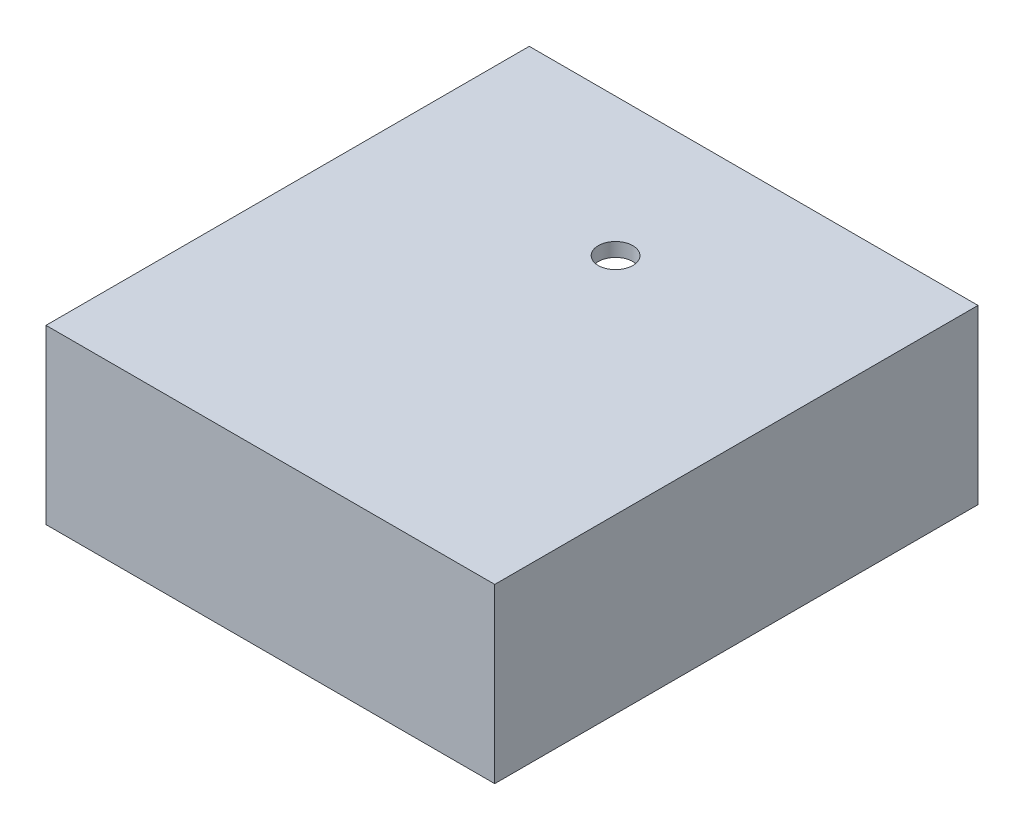
from build123d import *

# Parameters (mm, degrees)
SKETCH1_W           = 65
SKETCH1_H           = 70
BOSS_EXTRUDE1_DEPTH = 25
SKETCH8_W           = 61
SKETCH8_H           = 21
CUT_EXTRUDE1_DEPTH  = 40
SKETCH9_R           = 2.5
CUT_EXTRUDE2_DEPTH  = 30


with BuildPart() as part:
    # Sketch1 → Boss-Extrude1 (new body)
    with BuildSketch(Plane(origin=(0, 0, 0), x_dir=(1, 0, 0), z_dir=(0, 1, 0))):
        with Locations((32.5, -35)):
            Rectangle(SKETCH1_W, SKETCH1_H)
    extrude(amount=BOSS_EXTRUDE1_DEPTH)

    # Sketch8 → Cut-Extrude1 (cut)
    with BuildSketch(Plane(origin=(0, 0, 0), x_dir=(-1, 0, 0), z_dir=(0, 0, -1))):
        with Locations((-32.5, 12.5)):
            Rectangle(SKETCH8_W, SKETCH8_H)
    extrude(amount=-CUT_EXTRUDE1_DEPTH, mode=Mode.SUBTRACT)

    # Sketch9 → Cut-Extrude2 (cut)
    with BuildSketch(Plane(origin=(0, 25, 0), x_dir=(1, 0, 0), z_dir=(0, 1, 0))):
        with Locations(Location((32.5, -20, 0), (0, 0, 270))):
            Circle(SKETCH9_R)
    extrude(amount=-CUT_EXTRUDE2_DEPTH, mode=Mode.SUBTRACT)


solid = part.part
